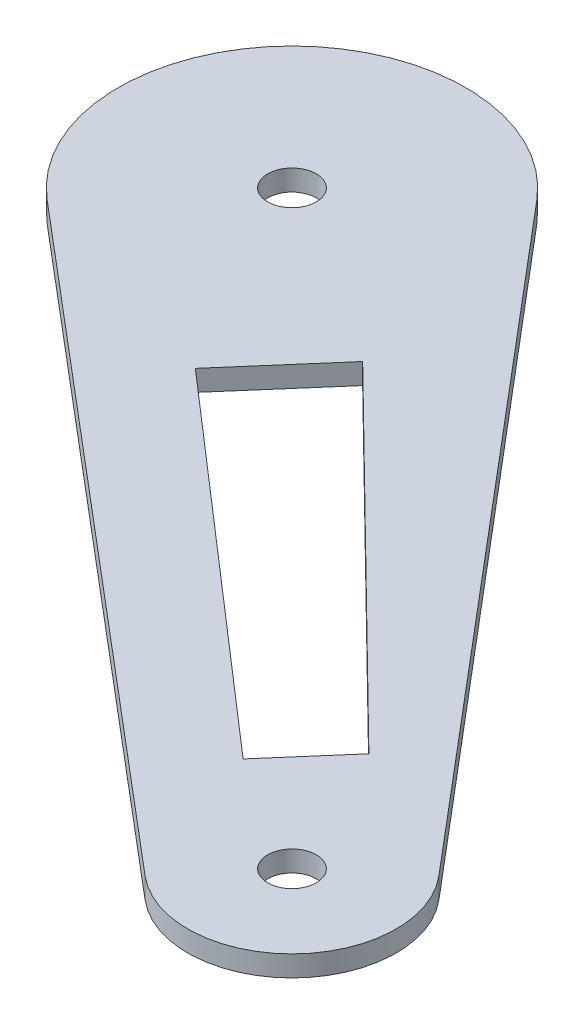
from build123d import *

# Parameters (mm, degrees)
EXTRUDE_2_DEPTH     = 3
SKETCH_4_R          = 2.25
SKETCH_4_R_2        = 2.5
CUT_EXTRUDE_2_DEPTH = 96.402519291
SKETCH_6_R          = 3.5
CUT_EXTRUDE_3_DEPTH = 96.402519291
SKETCH_7_R          = 3.5
CUT_EXTRUDE_4_DEPTH = 96.402519291
CUT_EXTRUDE_5_DEPTH = 96.402519291


with BuildPart() as part:
    # 草图2 → 凸台-拉伸2 (new body)
    with BuildSketch(Plane(origin=(0, 0, 0), x_dir=(1, 0, 0), z_dir=(0, 1, 0))):
        with BuildLine():
            Line((-58.569449541, 23.337085947), (32.740581269, -53.879999426))
            ThreePointArc((32.740581269, -53.879999426), (53.033008589, -53.033008589), (53.879999426, -32.740581269))
            Line((53.879999426, -32.740581269), (-23.337085947, 58.569449541))
            ThreePointArc((-23.337085947, 58.569449541), (-60.104076401, 60.104076401), (-58.569449541, 23.337085947))
        make_face()
    extrude(amount=EXTRUDE_2_DEPTH)

    # 草图4 → 切除-拉伸2 (cut, through all)
    with BuildSketch(Plane(origin=(0, 3, 0), x_dir=(1, 0, 0), z_dir=(0, 1, 0))):
        with Locations(Location((-42.426406871, 42.426406871, 0), (0, 0, 270))):
            Circle(SKETCH_4_R)
        with Locations(Location((42.426406871, -42.426406871, 0), (0, 0, 270))):
            Circle(SKETCH_4_R_2)
    extrude(amount=-CUT_EXTRUDE_2_DEPTH, mode=Mode.SUBTRACT)

    # 草图6 → 切除-拉伸3 (cut, through all)
    with BuildSketch(Plane(origin=(0, 3, 0), x_dir=(1, 0, 0), z_dir=(0, 1, 0))):
        with Locations(Location((-42.426406871, 42.426406871, 0), (0, 0, 270))):
            Circle(SKETCH_6_R)
    extrude(amount=-CUT_EXTRUDE_3_DEPTH, mode=Mode.SUBTRACT)

    # 草图7 → 切除-拉伸4 (cut, through all)
    with BuildSketch(Plane(origin=(0, 3, 0), x_dir=(1, 0, 0), z_dir=(0, 1, 0))):
        with Locations(Location((42.426406871, -42.426406871, 0), (0, 0, 270))):
            Circle(SKETCH_7_R)
    extrude(amount=-CUT_EXTRUDE_4_DEPTH, mode=Mode.SUBTRACT)

    # 草图8 → 切除-拉伸5 (cut, through all)
    with BuildSketch(Plane(origin=(0, 3, 0), x_dir=(1, 0, 0), z_dir=(0, 1, 0))):
        Polygon((33.626672858, -22.564710472), (-15.702999665, 25.870376375), (-26.891422763, 12.98046534), (25.218843822, -32.251166492), align=None)
    extrude(amount=-CUT_EXTRUDE_5_DEPTH, mode=Mode.SUBTRACT)


solid = part.part
